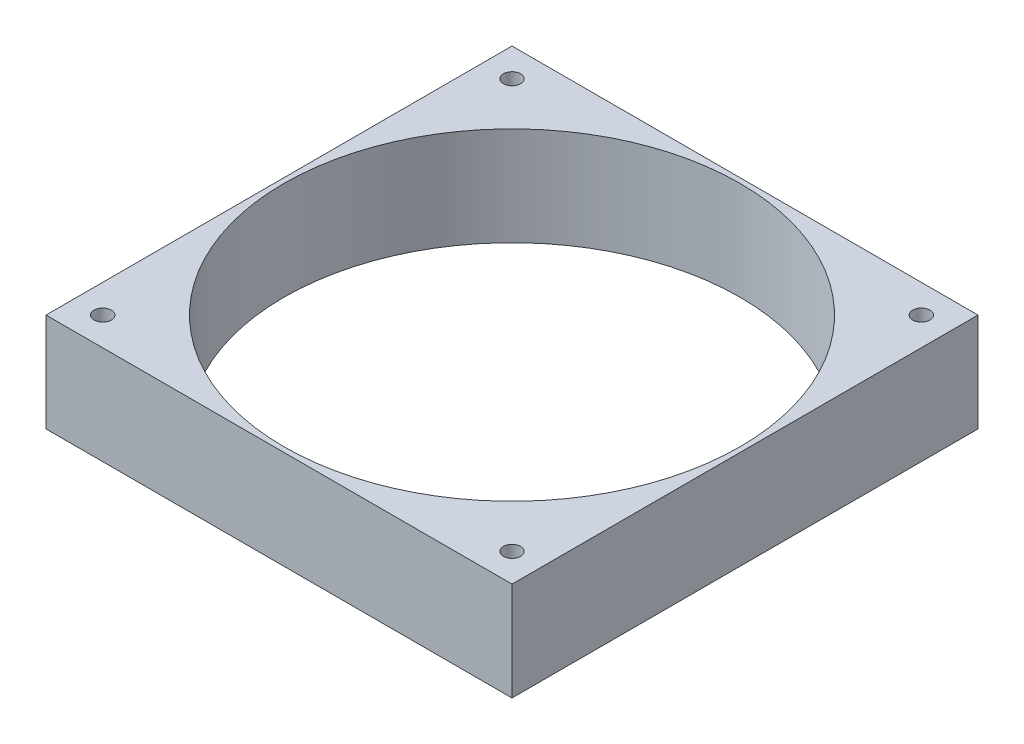
from build123d import *

# Parameters (mm, degrees)
SKETCH1_W           = 120.015
SKETCH1_H           = 120.015
SKETCH1_R           = 2.2225
BOSS_EXTRUDE1_DEPTH = 25.4
SKETCH2_R           = 58.7375
CUT_EXTRUDE1_DEPTH  = 89.583068995


with BuildPart() as part:
    # Sketch1 → Boss-Extrude1 (new body)
    with BuildSketch(Plane(origin=(0, 0, 0), x_dir=(1, 0, 0), z_dir=(0, 1, 0))):
        Rectangle(SKETCH1_W, SKETCH1_H)
        with Locations(Location((-52.705, 52.705, 0), (0, 0, 270))):
            Circle(SKETCH1_R, mode=Mode.SUBTRACT)
        with Locations(Location((52.705, -52.705, 0), (0, 0, 90))):
            Circle(SKETCH1_R, mode=Mode.SUBTRACT)
        with Locations(Location((52.705, 52.705, 0), (0, 0, 270))):
            Circle(SKETCH1_R, mode=Mode.SUBTRACT)
        with Locations(Location((-52.705, -52.705, 0), (0, 0, 90))):
            Circle(SKETCH1_R, mode=Mode.SUBTRACT)
    extrude(amount=BOSS_EXTRUDE1_DEPTH)

    # Sketch2 → Cut-Extrude1 (cut, through all)
    with BuildSketch(Plane(origin=(0, 25.4, 0), x_dir=(1, 0, 0), z_dir=(0, 1, 0))):
        with Locations(Location((0, 0, 0), (0, 0, 270))):
            Circle(SKETCH2_R)
    extrude(amount=-CUT_EXTRUDE1_DEPTH, mode=Mode.SUBTRACT)


solid = part.part
